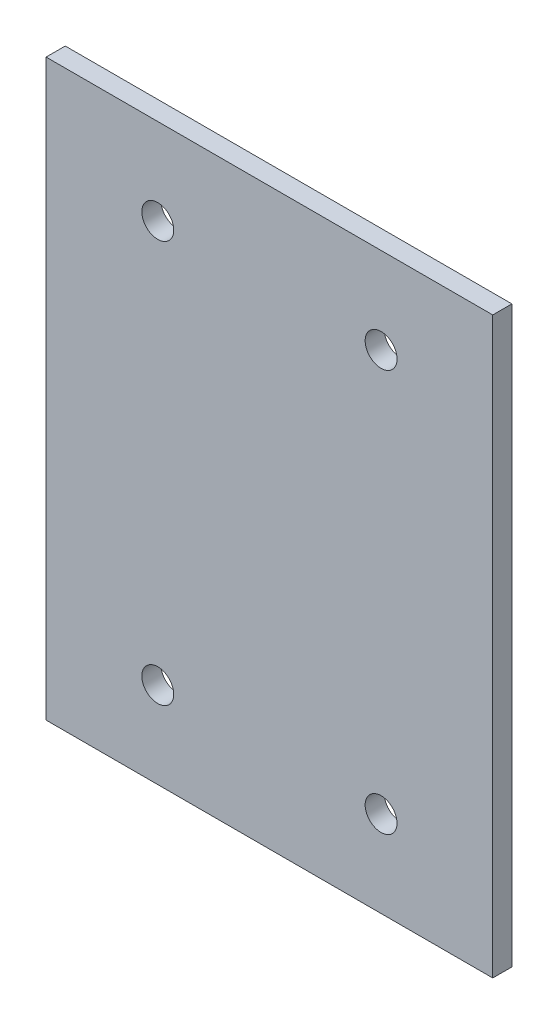
from build123d import *

# Parameters (mm, degrees)
SKETCH1_W           = 70
SKETCH1_H           = 90
BOSS_EXTRUDE1_DEPTH = 3
SKETCH2_R           = 2.5
CUT_EXTRUDE1_DEPTH  = 58.087651905


with BuildPart() as part:
    # Sketch1 → Boss-Extrude1 (new body)
    with BuildSketch(Plane.XY):
        Rectangle(SKETCH1_W, SKETCH1_H)
    extrude(amount=BOSS_EXTRUDE1_DEPTH)

    # Sketch2 → Cut-Extrude1 (cut, through all)
    with BuildSketch(Plane.XY.offset(3)):
        with Locations((-17.5, 31.5)):
            Circle(SKETCH2_R)
        with Locations((17.5, 31.5)):
            Circle(SKETCH2_R)
    cut_extrude1 = extrude(amount=-CUT_EXTRUDE1_DEPTH, mode=Mode.SUBTRACT)

    # Mirror1: Cut-Extrude1 across plane
    add(cut_extrude1.mirror(Plane.ZX), mode=Mode.SUBTRACT)


solid = part.part
